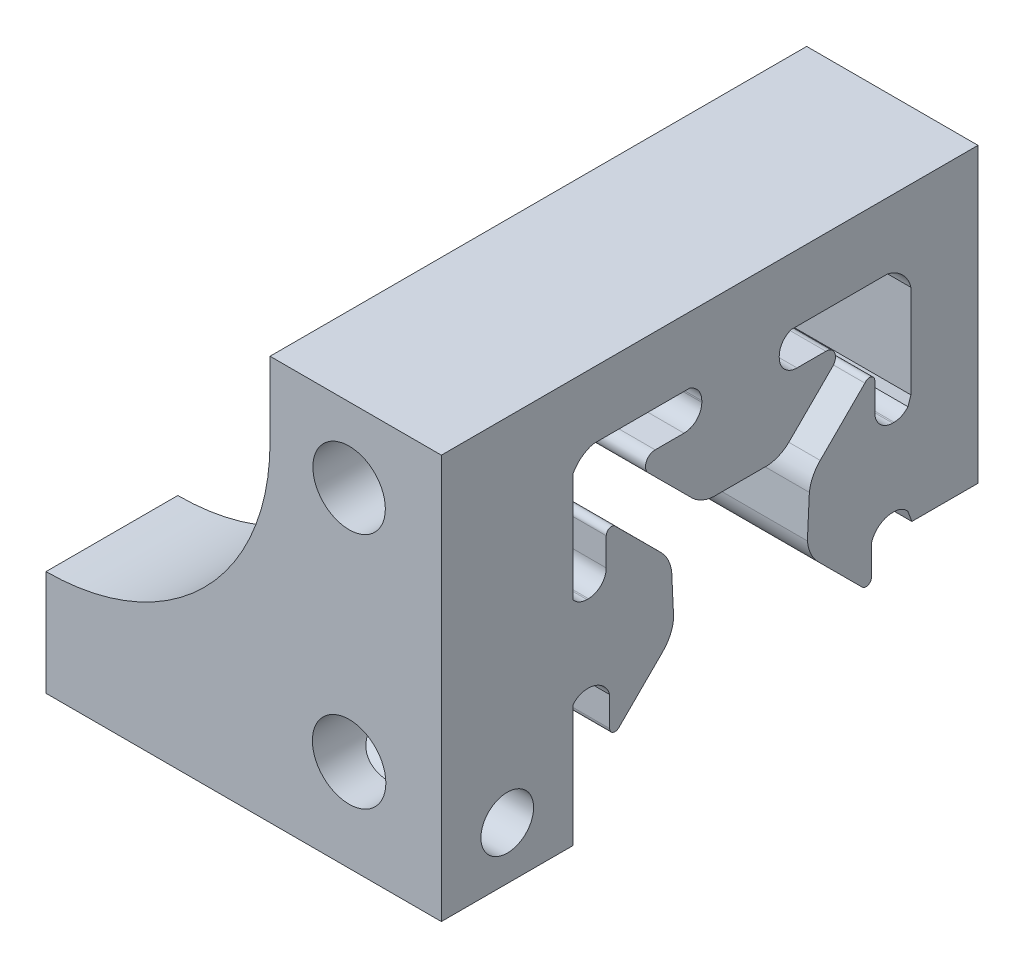
from build123d import *

# Parameters (mm, degrees)
BOSS_EXTRUDE1_DEPTH      = 5
BOSS_EXTRUDE1_DEPTH_BACK = 5
SKETCH7_R                = 2.788241988
SKETCH7_R_2              = 2.75
BOSS_EXTRUDE2_REACH      = 46.511
CUT_EXTRUDE3_REACH       = 76.833
SKETCH14_W               = 13
SKETCH14_H               = 1.848424097
SKETCH15_R               = 1.45
CUT_EXTRUDE4_DEPTH       = 3
CUT_EXTRUDE5_REACH       = 56.263
SKETCH16_R               = 2
FILLET1_R                = 0.5


with BuildPart() as part:
    # Sketch7 → Boss-Extrude1 (new, two sides: drawn at the far end of the back side and taken through both)
    with BuildSketch(Plane.XY.offset(-BOSS_EXTRUDE1_DEPTH_BACK)):
        with BuildLine():
            Line((30, 8), (30, 0))
            Line((30, 0), (60, 0))
            Line((60, 0), (60, 32.5))
            Line((60, 32.5), (47, 32.5))
            Line((47, 32.5), (47, 25))
            ThreePointArc((47, 25), (42.02081528, 12.97918472), (30, 8))
        make_face()
        with Locations((53, 7)):
            Circle(SKETCH7_R, mode=Mode.SUBTRACT)
        with Locations((53, 25)):
            Circle(SKETCH7_R_2, mode=Mode.SUBTRACT)
    extrude(amount=BOSS_EXTRUDE1_DEPTH + BOSS_EXTRUDE1_DEPTH_BACK)

    # Boss-Extrude2: up to this face of the body (flat: up to its plane)
    boss_extrude2_end = Plane(part.part.faces().sort_by_distance((47, 28.75, 0))[0])
    # Sketch8 → Boss-Extrude2 (add, up to the picked face)
    with BuildSketch(Plane(origin=(60, 0, 0), x_dir=(0, 0, -1), z_dir=(1, 0, 0)), mode=Mode.PRIVATE) as boss_extrude2_sk1:
        with BuildLine():
            Line((7.770224858, 6.297913321), (7.77021842, 8.534450023))
            ThreePointArc((7.77021842, 8.534450023), (7.172653823, 9.41960576), (6.160789156, 9.761240102))
            Line((6.160789156, 9.761240102), (6.049331791, 9.761231883))
            ThreePointArc((6.049331791, 9.761231883), (5.467920254, 9.629507338), (5, 9.260127632))
            Line((5, 9.260127632), (5, 16.139290416))
            ThreePointArc((5, 16.139290416), (5.467793594, 15.770087219), (6.049012407, 15.638456908))
            Line((6.049012407, 15.638456908), (6.160787586, 15.638456908))
            ThreePointArc((6.160787586, 15.638456908), (7.114683416, 16.033573497), (7.509800005, 16.987469327))
            Line((7.509800005, 16.987469327), (7.509800005, 19.102089972))
            ThreePointArc((7.509800005, 19.102089972), (7.80571774, 19.4939479), (8.26359849, 19.316563682))
            Line((8.26359849, 19.316563682), (11.653749185, 15.934160795))
            ThreePointArc((11.653749185, 15.934160795), (12.207484328, 15.158579301), (12.477275173, 14.244597811))
            Line((12.477275173, 14.244597811), (12.625702616, 11.128406988))
            ThreePointArc((12.625702616, 11.128406988), (12.368540167, 10.154062981), (11.790945096, 9.328313198))
            Line((11.790945096, 9.328313198), (8.480768071, 6.02568809))
            ThreePointArc((8.480768071, 6.02568809), (8.03188202, 5.917454844), (7.770224858, 6.297913321))
        make_face()
    boss_extrude2_tool1 = split(extrude(boss_extrude2_sk1.sketch, amount=-BOSS_EXTRUDE2_REACH, mode=Mode.PRIVATE), bisect_by=boss_extrude2_end, keep=Keep.BOTH, mode=Mode.PRIVATE)
    # Sketch8 → Boss-Extrude2 (add, up to the picked face)
    with BuildSketch(Plane(origin=(60, 0, 0), x_dir=(0, 0, -1), z_dir=(1, 0, 0)), mode=Mode.PRIVATE) as boss_extrude2_sk2:
        with BuildLine():
            Line((30.631565341, 16.79432062), (30.631565341, 23.861822271))
            ThreePointArc((30.631565341, 23.861822271), (29.994638774, 24.994670327), (28.861778916, 25.631575903))
            Line((28.861778916, 25.631575903), (21.563333135, 25.631575903))
            ThreePointArc((21.563333135, 25.631575903), (20.893881396, 25.140801297), (20.6385, 24.350987593))
            Line((20.6385, 24.350987593), (20.6385, 24.239212407))
            ThreePointArc((20.6385, 24.239212407), (21.033616586, 23.285316586), (21.987512407, 22.8902))
            Line((21.987512407, 22.8902), (24.176788598, 22.8902))
            ThreePointArc((24.176788598, 22.8902), (24.854992901, 22.436757749), (24.695146796, 21.63674514))
            Line((24.695146796, 21.63674514), (21.386383353, 18.335543623))
            ThreePointArc((21.386383353, 18.335543623), (20.461951665, 17.745653619), (19.375383804, 17.597618335))
            Line((19.375383804, 17.597618335), (16.024616196, 17.597618335))
            ThreePointArc((16.024616196, 17.597618335), (14.938048335, 17.745653619), (14.013616647, 18.335543623))
            Line((14.013616647, 18.335543623), (10.704853204, 21.63674514))
            ThreePointArc((10.704853204, 21.63674514), (10.545007099, 22.436757749), (11.223211402, 22.8902))
            Line((11.223211402, 22.8902), (13.412487593, 22.8902))
            ThreePointArc((13.412487593, 22.8902), (14.366383414, 23.285316586), (14.7615, 24.239212407))
            Line((14.7615, 24.239212407), (14.7615, 24.350987593))
            ThreePointArc((14.7615, 24.350987593), (14.506118604, 25.140801297), (13.836666865, 25.631575903))
            Line((13.836666865, 25.631575903), (6.538221084, 25.631575903))
            ThreePointArc((6.538221084, 25.631575903), (5.64574769, 25.205085259), (5, 24.455810309))
            Line((5, 24.455810309), (5, 30.651575903))
            Line((5, 30.651575903), (35.719846982, 30.651575903))
            Line((35.719846982, 30.651575903), (35.719846982, 25.680977676))
            Line((35.719846982, 25.680977676), (35.719846982, 8.441932485))
            Line((35.719846982, 8.441932485), (30.699526538, 8.441932485))
            Line((30.699526538, 8.441932485), (30.4, 9.260127632))
            ThreePointArc((30.4, 9.260127632), (29.932079746, 9.629507338), (29.350668209, 9.761231883))
            Line((29.350668209, 9.761231883), (29.239210844, 9.761240102))
            ThreePointArc((29.239210844, 9.761240102), (28.227346177, 9.41960576), (27.62978158, 8.534450023))
            Line((27.62978158, 8.534450023), (27.629775142, 6.29790377))
            ThreePointArc((27.629775142, 6.29790377), (27.368113521, 5.917453135), (26.919231929, 6.02568809))
            Line((26.919231929, 6.02568809), (23.609054904, 9.328313198))
            ThreePointArc((23.609054904, 9.328313198), (23.031459833, 10.154062981), (22.774297384, 11.128406988))
            Line((22.774297384, 11.128406988), (22.922724827, 14.244597811))
            ThreePointArc((22.922724827, 14.244597811), (23.192519205, 15.158586549), (23.746262232, 15.934172186))
            Line((23.746262232, 15.934172186), (27.13640151, 19.316563682))
            ThreePointArc((27.13640151, 19.316563682), (27.594282383, 19.493947864), (27.890199995, 19.102089715))
            Line((27.890199995, 19.102089715), (27.890199995, 16.987469327))
            ThreePointArc((27.890199995, 16.987469327), (28.285316584, 16.033573497), (29.239212414, 15.638456908))
            Line((29.239212414, 15.638456908), (29.350987593, 15.638456908))
            ThreePointArc((29.350987593, 15.638456908), (29.932206406, 15.770087219), (30.4, 16.139290416))
            Line((30.4, 16.139290416), (30.631565341, 16.79432062))
        make_face()
    boss_extrude2_tool2 = split(extrude(boss_extrude2_sk2.sketch, amount=-BOSS_EXTRUDE2_REACH, mode=Mode.PRIVATE), bisect_by=boss_extrude2_end, keep=Keep.BOTH, mode=Mode.PRIVATE)
    add(boss_extrude2_tool1.solids().sort_by(Axis((60, 12.678642, -8.819589), (-1, 0, 0)))[0])
    add(boss_extrude2_tool2.solids().sort_by(Axis((60, 21.642021, -23.841508), (-1, 0, 0)))[0])

    # Sketch14 → Cut-Extrude3 (cut, up to next)
    with BuildSketch(Plane(origin=(0, 0, -5), x_dir=(-1, 0, 0), z_dir=(0, 0, -1)), mode=Mode.PRIVATE) as cut_extrude3_sk1:
        with Locations((-53.5, 31.575787952)):
            Rectangle(SKETCH14_W, SKETCH14_H)
    cut_extrude3_tool1 = extrude(cut_extrude3_sk1.sketch, amount=-CUT_EXTRUDE3_REACH, mode=Mode.PRIVATE) & part.part
    add(cut_extrude3_tool1.solids().sort_by_distance((53.5, 31.575788, -5))[0], mode=Mode.SUBTRACT)

    # Sketch15 → Cut-Extrude4 (cut)
    with BuildSketch(Plane.ZY.offset(-30)):
        with Locations(Location((0, 4, 0), (0, 0, 270))):
            Circle(SKETCH15_R)
    extrude(amount=-CUT_EXTRUDE4_DEPTH, mode=Mode.SUBTRACT)

    # Sketch16 → Cut-Extrude5 (cut, up to next)
    with BuildSketch(Plane.ZY.offset(-33), mode=Mode.PRIVATE) as cut_extrude5_sk1:
        with Locations(Location((0, 4, 0), (0, 0, 270))):
            Circle(SKETCH16_R)
    cut_extrude5_tool1 = extrude(cut_extrude5_sk1.sketch, amount=-CUT_EXTRUDE5_REACH, mode=Mode.PRIVATE) & part.part
    add(cut_extrude5_tool1.solids().sort_by_distance((33, 4, 0))[0], mode=Mode.SUBTRACT)

    # Fillet1
    fillet1_edges = [part.edges().sort_by_distance(p)[0] for p in [
        (33, 6, 0),
    ]]
    fillet(fillet1_edges, radius=FILLET1_R)


solid = part.part
